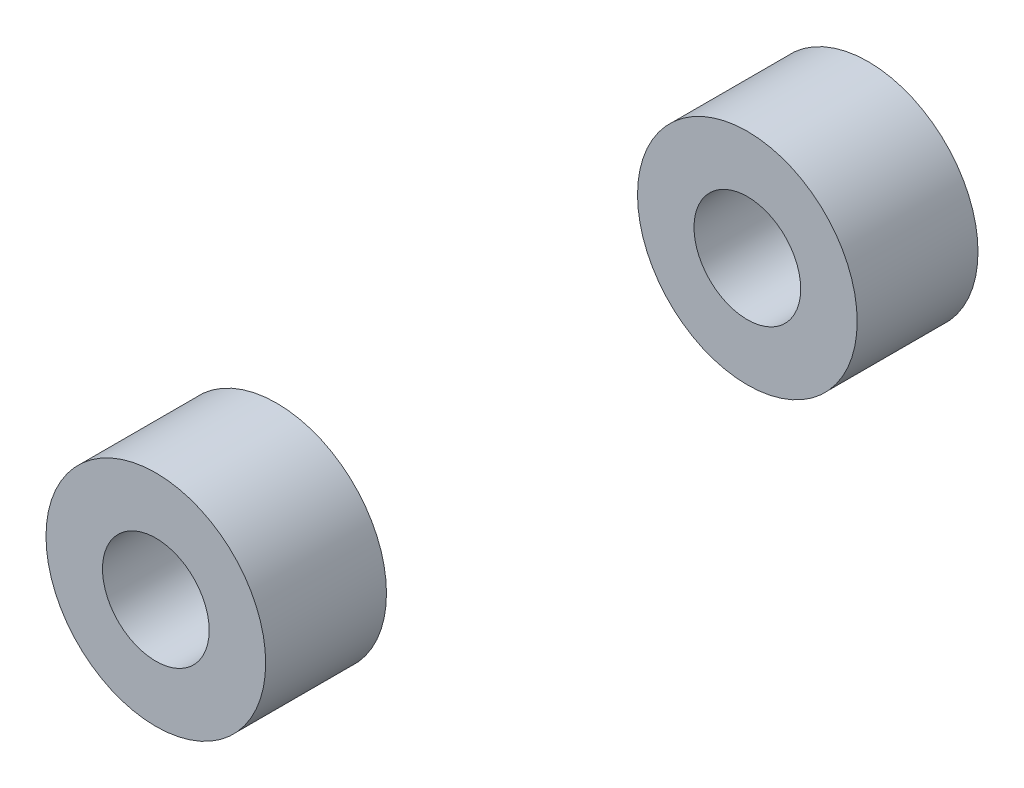
from build123d import *

# Parameters (mm, degrees)
SKETCH_1_R          = 3.5
SKETCH_1_R_2        = 1.7
EXTRUDE_1_DEPTH     = 22.7
SKETCH_2_R          = 3.5
CUT_EXTRUDE_1_DEPTH = 7.5


with BuildPart() as part:
    # 草图1 → 凸台-拉伸1 (new body)
    with BuildSketch(Plane.XY):
        Circle(SKETCH_1_R)
        Circle(SKETCH_1_R_2, mode=Mode.SUBTRACT)
    extrude(amount=EXTRUDE_1_DEPTH)

    # 草图2 → 切除-拉伸1 (cut, symmetric)
    with BuildSketch(Plane.XY.offset(11.35)):
        Circle(SKETCH_2_R)
    extrude(amount=CUT_EXTRUDE_1_DEPTH, both=True, mode=Mode.SUBTRACT)


with BuildPart() as cut_extrude_1_piece_1:
    # of the separate pieces the step leaves, piece 1, a body of its own (cut_extrude_1_pieces)
    add(part.part.solids().sort_by_distance((3.5, 0, 0))[0])


with BuildPart() as cut_extrude_1_piece_2:
    # of the separate pieces the step leaves, piece 2, a body of its own (cut_extrude_1_pieces)
    add(part.part.solids().sort_by_distance((3.5, 0, 18.85))[0])


solid = Compound([cut_extrude_1_piece_1.part, cut_extrude_1_piece_2.part])
